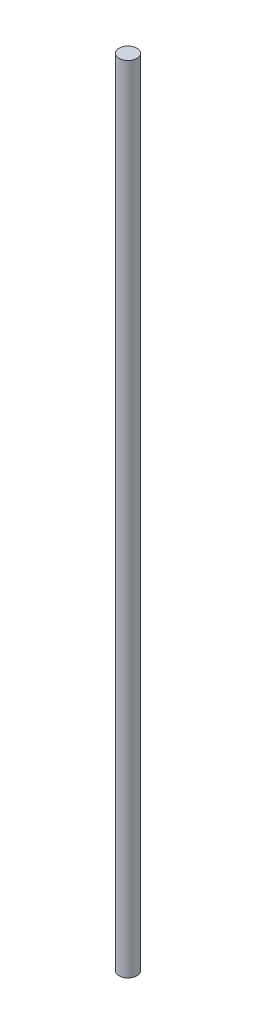
from build123d import *

# Parameters (mm, degrees)
SKETCH1_R           = 6
BOSS_EXTRUDE1_DEPTH = 536


with BuildPart() as part:
    # Sketch1 → Boss-Extrude1 (new body)
    with BuildSketch(Plane(origin=(0, 0, 0), x_dir=(1, 0, 0), z_dir=(0, 1, 0))):
        with Locations(Location((0, 0, 0), (0, 0, 270))):
            Circle(SKETCH1_R)
    extrude(amount=BOSS_EXTRUDE1_DEPTH)


solid = part.part
